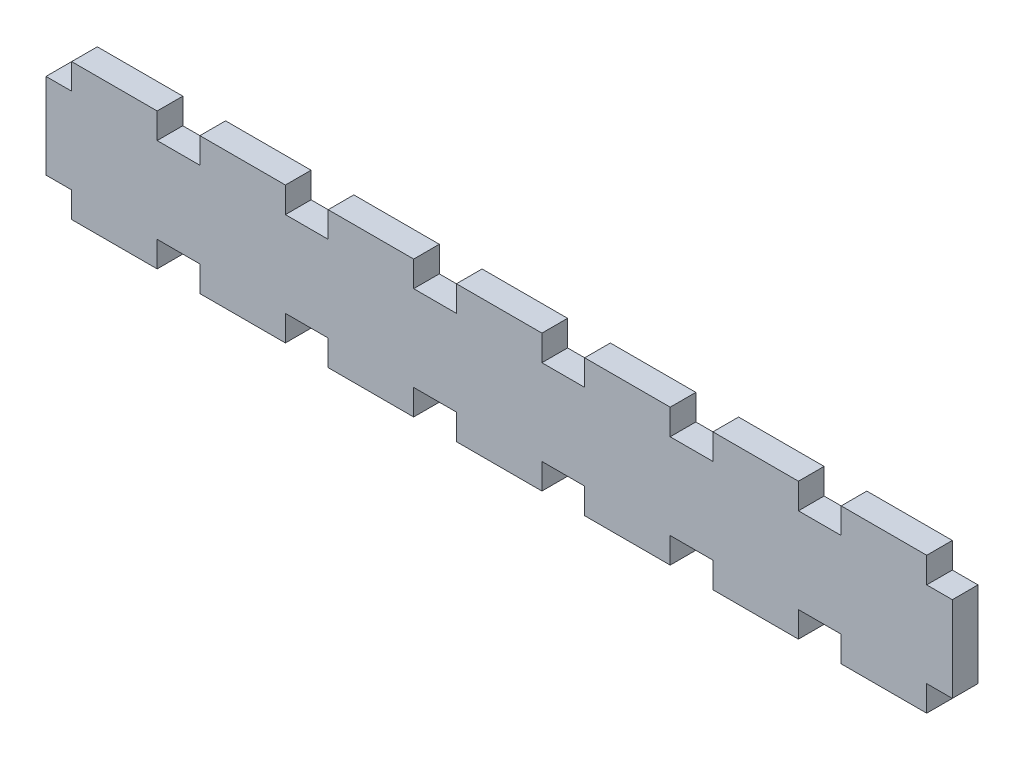
from build123d import *

# Parameters (mm, degrees)
EXTRUDE_1_DEPTH = 3


with BuildPart() as part:
    # 草图1 → 凸台-拉伸1 (new body)
    with BuildSketch(Plane.XY):
        Polygon((-35, 5), (-35, 8), (-25, 8), (-25, 5), (-20, 5), (-20, 8), (-10, 8), (-10, 5), (-5, 5), (-5, 8), (5, 8), (5, 5), (10, 5), (10, 8), (20, 8), (20, 5), (25, 5), (25, 8), (35, 8), (35, 5), (40, 5), (40, 8), (50, 8), (50, 5), (53, 5), (53, -5), (50, -5), (50, -8), (40, -8), (40, -5), (35, -5), (35, -8), (25, -8), (25, -5), (20, -5), (20, -8), (10, -8), (10, -5), (5, -5), (5, -8), (-5, -8), (-5, -5), (-10, -5), (-10, -8), (-20, -8), (-20, -5), (-25, -5), (-25, -8), (-35, -8), (-35, -5), (-40, -5), (-40, -8), (-50, -8), (-50, -5), (-53, -5), (-53, 5), (-50, 5), (-50, 8), (-40, 8), (-40, 5), align=None)
    extrude(amount=EXTRUDE_1_DEPTH)


solid = part.part
